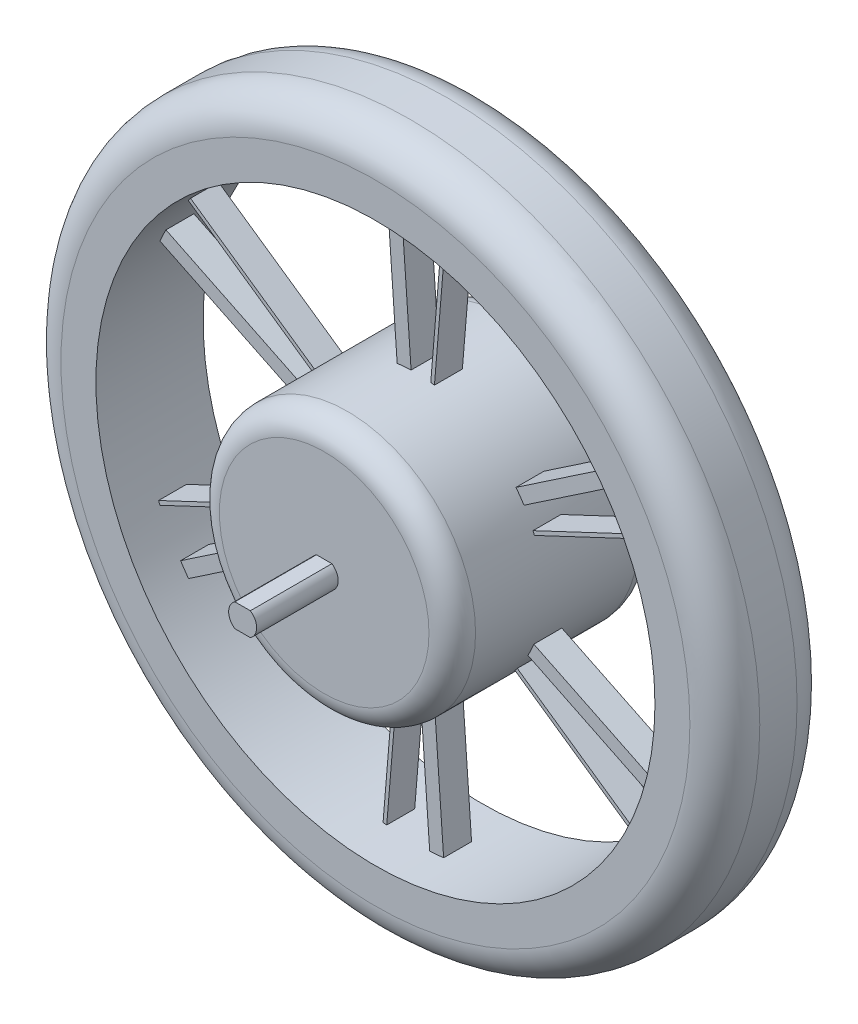
from build123d import *

# Parameters (mm, degrees)
SKETCH1_R           = 55
BOSS_EXTRUDE1_DEPTH = 45
SKETCH2_R           = 150
SKETCH2_R_2         = 120
BOSS_EXTRUDE2_DEPTH = 23
BOSS_EXTRUDE3_DEPTH = 6
CIRPATTERN15_COUNT  = 6
FILLET1_R           = 15
BOSS_EXTRUDE4_DEPTH = 35
FILLET2_R           = 10


with BuildPart() as part:
    # Sketch1 → Boss-Extrude1 (new, symmetric)
    with BuildSketch(Plane.XY):
        Circle(SKETCH1_R)
    extrude(amount=BOSS_EXTRUDE1_DEPTH, both=True)



with BuildPart() as body_2:
    # Sketch2 → Boss-Extrude2 (new, symmetric)
    with BuildSketch(Plane.XY):
        Circle(SKETCH2_R)
        Circle(SKETCH2_R_2, mode=Mode.SUBTRACT)
    extrude(amount=BOSS_EXTRUDE2_DEPTH, both=True)


with BuildPart() as part_1:
    add(part.part)

    add(body_2.part)  # Boss-Extrude3 merges body 2
    # Sketch3 → Boss-Extrude3 (add, symmetric)
    with BuildSketch(Plane.XY):
        with BuildLine():
            Line((-6.292975555, 119.834879975), (-1.690507098, 54.974013732))
            ThreePointArc((-1.690507098, 54.974013732), (-4.686886811, 54.799936971), (-7.669308753, 54.462663387))
            Line((-7.669308753, 54.462663387), (-12.275111778, 119.370522454))
            ThreePointArc((-12.275111778, 119.370522454), (-9.286946418, 119.640096231), (-6.292975555, 119.834879975))
        make_face()
        with BuildLine():
            Line((13.724408526, 119.212585789), (8.33039605, 54.365471594))
            ThreePointArc((8.33039605, 54.365471594), (7.542379524, 54.480386481), (6.752781779, 54.583879839))
            Line((6.752781779, 54.583879839), (12.142889029, 119.38404519))
            ThreePointArc((12.142889029, 119.38404519), (12.933932901, 119.300936206), (13.724408526, 119.212585789))
        make_face()
    boss_extrude3 = extrude(amount=BOSS_EXTRUDE3_DEPTH, both=True)

    # CirPattern15: Boss-Extrude3 ×6 about axis
    cirpattern15_axis = Axis((0, 0, -53.35), (0, 0, 1))
    for i in range(1, CIRPATTERN15_COUNT):
        add(boss_extrude3.rotate(cirpattern15_axis, i * 360 / CIRPATTERN15_COUNT))

    # Fillet1
    fillet1_edges = [part_1.edges().sort_by_distance(p)[0] for p in [
        (-150, 0, -23),
        (-150, 0, 23),
    ]]
    fillet(fillet1_edges, radius=FILLET1_R)

    # Sketch5 → Boss-Extrude4 (add)
    with BuildSketch(Plane.XY.offset(45)):
        with BuildLine():
            Line((-3.31662479, 5), (3.31662479, 5))
            ThreePointArc((3.31662479, 5), (6, 0), (3.31662479, -5))
            Line((3.31662479, -5), (-3.31662479, -5))
            ThreePointArc((-3.31662479, -5), (-6, 0), (-3.31662479, 5))
        make_face()
    boss_extrude4 = extrude(amount=BOSS_EXTRUDE4_DEPTH)

    # Mirror1: Boss-Extrude4 across plane
    add(boss_extrude4.mirror(Plane.XY))

    # Fillet2
    fillet2_edges = [part_1.edges().sort_by_distance(p)[0] for p in [
        (-55, 0, 45),
        (-55, 0, -45),
    ]]
    fillet(fillet2_edges, radius=FILLET2_R)


solid = part_1.part
